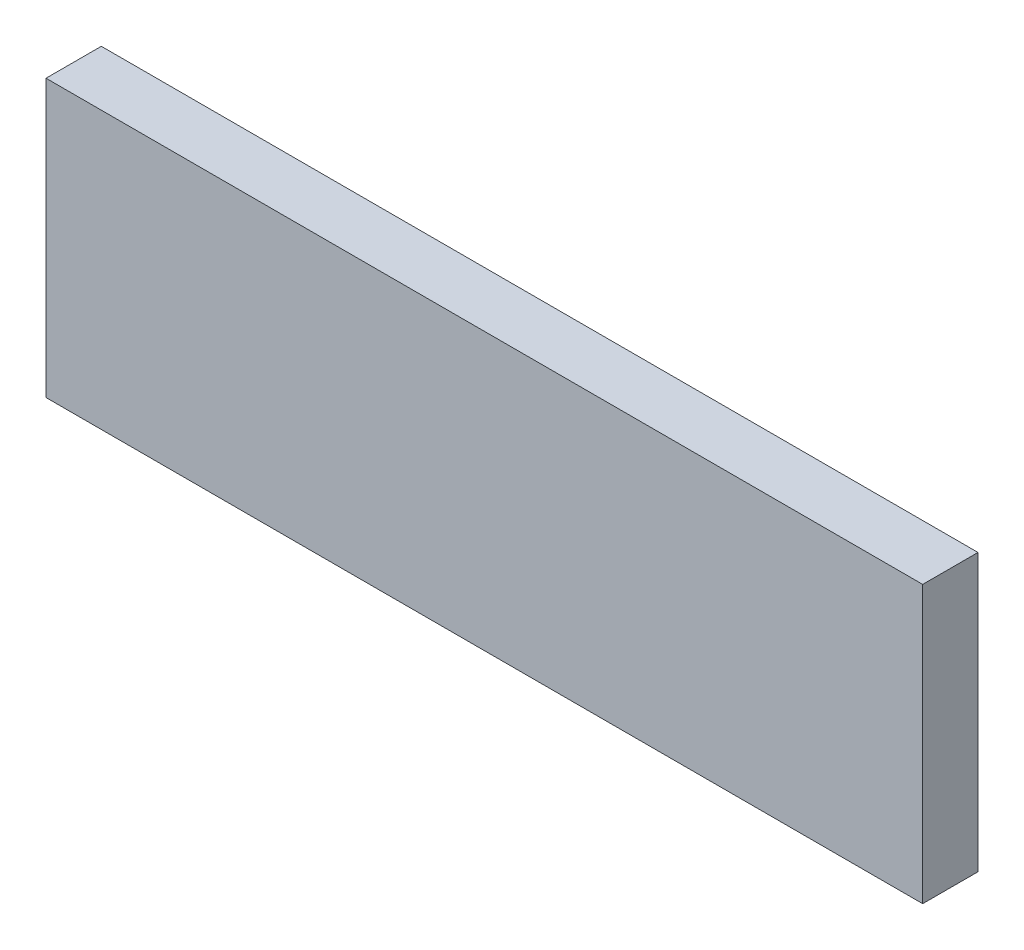
from build123d import *

# Parameters (mm, degrees)
SKETCH_1_W      = 317
SKETCH_1_H      = 20
EXTRUDE_1_DEPTH = 100


with BuildPart() as part:
    # 草图1 → 凸台-拉伸1 (new body)
    with BuildSketch(Plane(origin=(0, 0, 0), x_dir=(1, 0, 0), z_dir=(0, 1, 0))):
        with Locations((158.5, -10)):
            Rectangle(SKETCH_1_W, SKETCH_1_H)
    extrude(amount=EXTRUDE_1_DEPTH)


solid = part.part
